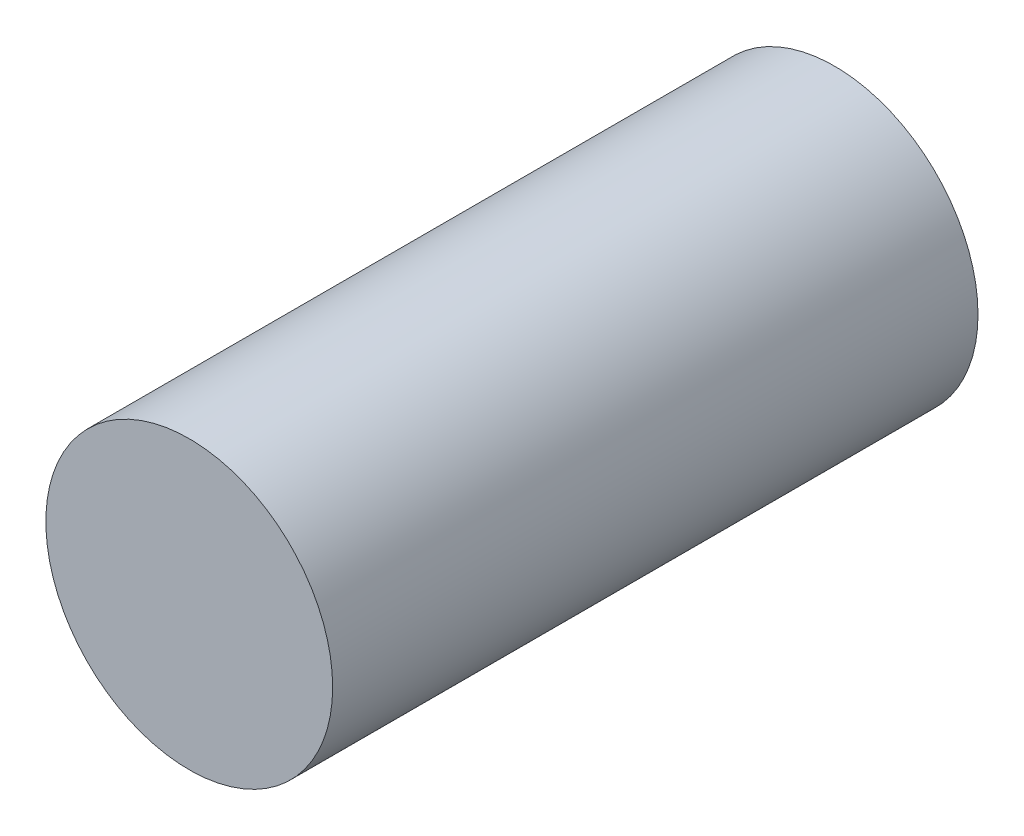
from build123d import *

# Parameters (mm, degrees)
SKETCH_1_R      = 20
EXTRUDE_1_DEPTH = 90


with BuildPart() as part:
    # 草图1 → 凸台-拉伸1 (new body)
    with BuildSketch(Plane.XY):
        with Locations((21.594339623, 0)):
            Circle(SKETCH_1_R)
    extrude(amount=-EXTRUDE_1_DEPTH)


solid = part.part
